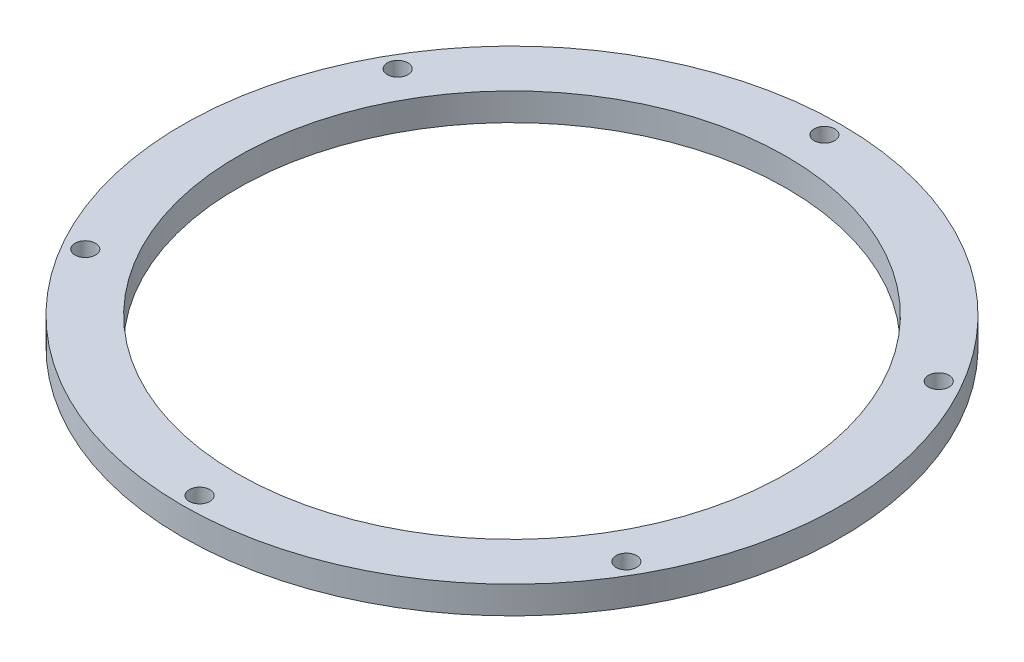
from build123d import *

# Parameters (mm, degrees)
SKETCH_1_R      = 48
SKETCH_1_R_2    = 40
SKETCH_1_R_3    = 1.5
EXTRUDE_1_DEPTH = 4


with BuildPart() as part:
    # 草图1 → 凸台-拉伸1 (new body)
    with BuildSketch(Plane(origin=(0, 0, 0), x_dir=(1, 0, 0), z_dir=(0, 1, 0))):
        with Locations(Location((0, 0, 0), (0, 0, 270))):
            Circle(SKETCH_1_R)
        with Locations(Location((0, 0, 0), (0, 0, 270))):
            Circle(SKETCH_1_R_2, mode=Mode.SUBTRACT)
        with Locations(Location((0, -45.5, 0), (0, 0, 270))):
            Circle(SKETCH_1_R_3, mode=Mode.SUBTRACT)
        with Locations(Location((-39.404155872, -22.75, 0), (0, 0, 270))):
            Circle(SKETCH_1_R_3, mode=Mode.SUBTRACT)
        with Locations(Location((-39.404155872, 22.75, 0), (0, 0, 270))):
            Circle(SKETCH_1_R_3, mode=Mode.SUBTRACT)
        with Locations(Location((0, 45.5, 0), (0, 0, 270))):
            Circle(SKETCH_1_R_3, mode=Mode.SUBTRACT)
        with Locations(Location((39.404155872, 22.75, 0), (0, 0, 270))):
            Circle(SKETCH_1_R_3, mode=Mode.SUBTRACT)
        with Locations(Location((39.404155872, -22.75, 0), (0, 0, 270))):
            Circle(SKETCH_1_R_3, mode=Mode.SUBTRACT)
    extrude(amount=EXTRUDE_1_DEPTH)


solid = part.part
